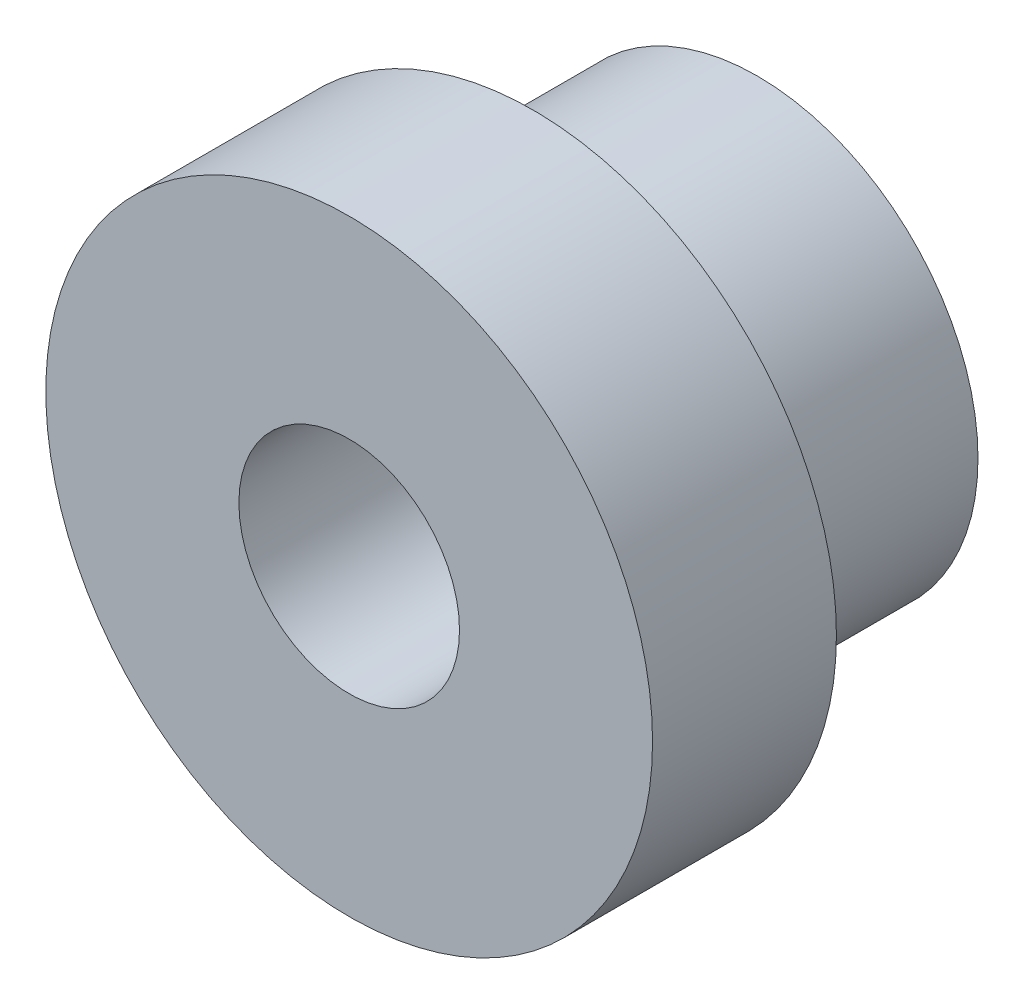
from build123d import *

# Parameters (mm, degrees)
IZIM1_R                     = 6
IZIM1_R_2                   = 3
Y_KSEKLIK_EKSTR_ZYON1_DEPTH = 11.1
Y_KSEKLIK_EKSTR_ZYON2_START = -5
IZIM2_R                     = 8.25
IZIM2_R_2                   = 3
Y_KSEKLIK_EKSTR_ZYON2_DEPTH = 5


with BuildPart() as part:
    # Çizim1 → Yükseklik-Ekstrüzyon1 (new body)
    with BuildSketch(Plane.XY):
        Circle(IZIM1_R)
        Circle(IZIM1_R_2, mode=Mode.SUBTRACT)
    extrude(amount=Y_KSEKLIK_EKSTR_ZYON1_DEPTH)

    # Çizim2 → Yükseklik-Ekstrüzyon2 (add)
    with BuildSketch(Plane.XY.offset(11.1).offset(Y_KSEKLIK_EKSTR_ZYON2_START)):
        Circle(IZIM2_R)
        Circle(IZIM2_R_2, mode=Mode.SUBTRACT)
    extrude(amount=Y_KSEKLIK_EKSTR_ZYON2_DEPTH)


solid = part.part
